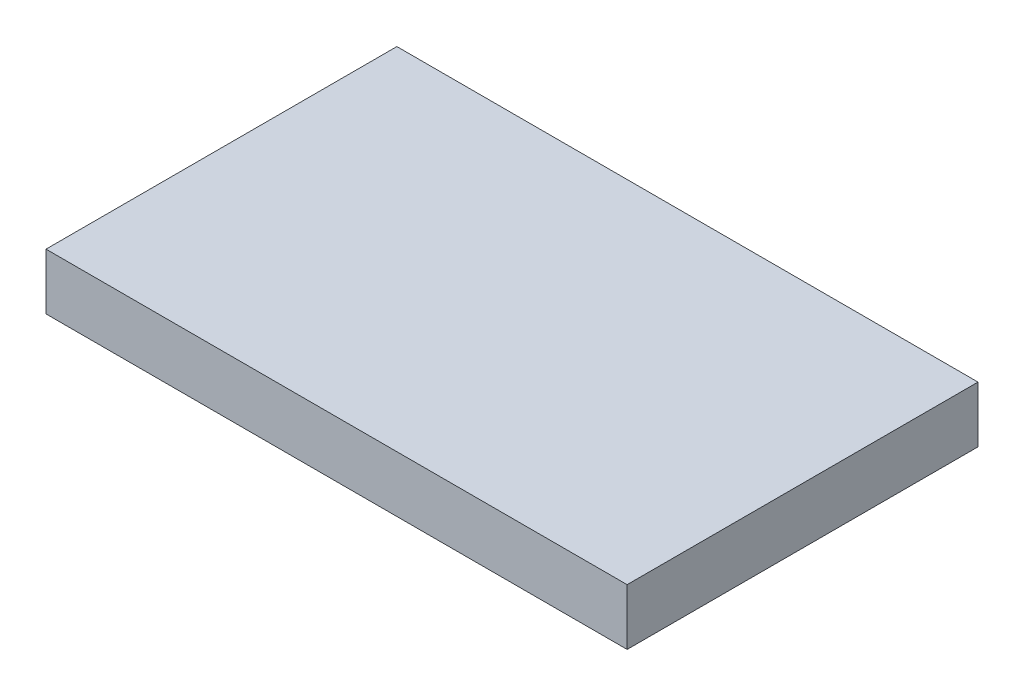
from build123d import *

# Parameters (mm, degrees)
SKETCH1_W           = 26.306181488
SKETCH1_H           = 15.882977503
BOSS_EXTRUDE1_DEPTH = 2.54


with BuildPart() as part:
    # Sketch1 → Boss-Extrude1 (new body)
    with BuildSketch(Plane(origin=(0, 0, 0), x_dir=(1, 0, 0), z_dir=(0, 1, 0))):
        with Locations((-92.319806734, -4.094830137)):
            Rectangle(SKETCH1_W, SKETCH1_H)
    extrude(amount=BOSS_EXTRUDE1_DEPTH)


solid = part.part
